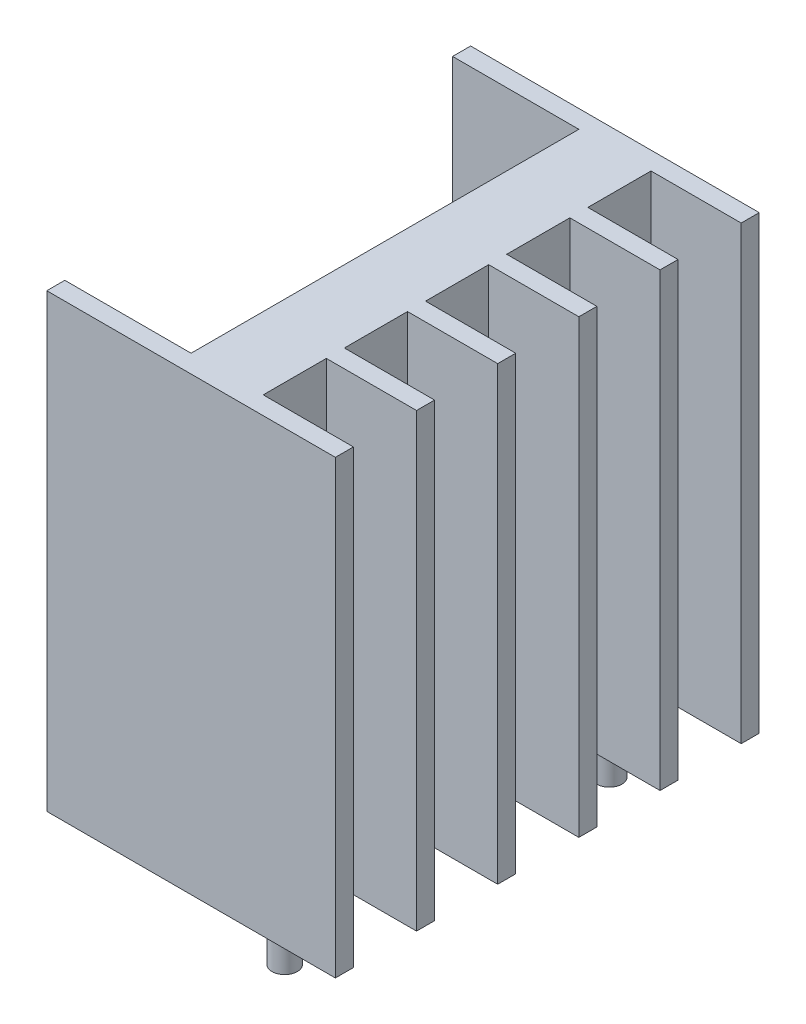
from build123d import *

# Parameters (mm, degrees)
SKETCH1_W           = 4
SKETCH1_H           = 23.5
BOSS_EXTRUDE1_DEPTH = 25
SKETCH2_W           = 5
SKETCH2_H           = 1
SKETCH2_W_2         = 7
BOSS_EXTRUDE2_DEPTH = 25
SKETCH3_R           = 1.6
CUT_EXTRUDE1_DEPTH  = 25
SKETCH4_R           = 0.7
BOSS_EXTRUDE3_DEPTH = 3.5


with BuildPart() as part:
    # Sketch1 → Boss-Extrude1 (new body)
    with BuildSketch(Plane(origin=(0, 0, 0), x_dir=(1, 0, 0), z_dir=(0, 1, 0))):
        Rectangle(SKETCH1_W, SKETCH1_H)
    extrude(amount=BOSS_EXTRUDE1_DEPTH)

    # Sketch2 → Boss-Extrude2 (add)
    with BuildSketch(Plane(origin=(0, 25, 0), x_dir=(1, 0, 0), z_dir=(0, 1, 0))):
        with Locations((4.5, -11.25)):
            Rectangle(SKETCH2_W, SKETCH2_H)
        with Locations((-5.5, -11.25)):
            Rectangle(SKETCH2_W_2, SKETCH2_H)
        with Locations((-5.5, 11.25)):
            Rectangle(SKETCH2_W_2, SKETCH2_H)
        with Locations((4.5, 11.25)):
            Rectangle(SKETCH2_W, SKETCH2_H)
        with Locations((4.5, 6.75)):
            Rectangle(SKETCH2_W, SKETCH2_H)
        with Locations((4.5, 2.25)):
            Rectangle(SKETCH2_W, SKETCH2_H)
        with Locations((4.5, -2.25)):
            Rectangle(SKETCH2_W, SKETCH2_H)
        with Locations((4.5, -6.75)):
            Rectangle(SKETCH2_W, SKETCH2_H)
    extrude(amount=-BOSS_EXTRUDE2_DEPTH)

    # Sketch3 → Cut-Extrude1 (cut)
    with BuildSketch(Plane.ZY.offset(2)):
        with Locations((0, 18)):
            Circle(SKETCH3_R)
    extrude(amount=-CUT_EXTRUDE1_DEPTH, mode=Mode.SUBTRACT)

    # Sketch4 → Boss-Extrude3 (add)
    with BuildSketch(Plane.XZ):
        with Locations(Location((1.43876577, 9, 0), (0, 0, 36.701194363))):
            Circle(SKETCH4_R)
        with Locations(Location((1.43876577, -9, 0), (0, 0, 36.701194363))):
            Circle(SKETCH4_R)
    extrude(amount=BOSS_EXTRUDE3_DEPTH)


solid = part.part
